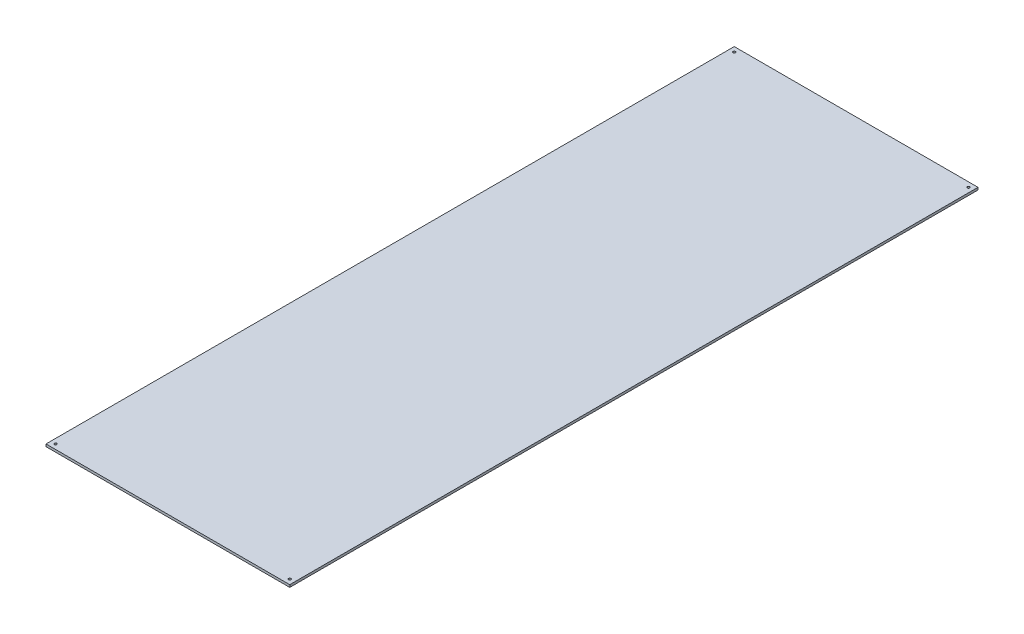
from build123d import *

# Parameters (mm, degrees)
SKETCH1_W           = 647.7
SKETCH1_H           = 1828.8
BOSS_EXTRUDE1_DEPTH = 6.35
SKETCH2_R           = 3.175
CUT_EXTRUDE1_DEPTH  = 971.075515102


with BuildPart() as part:
    # Sketch1 → Boss-Extrude1 (new body)
    with BuildSketch(Plane(origin=(0, 0, 0), x_dir=(1, 0, 0), z_dir=(0, 1, 0))):
        Rectangle(SKETCH1_W, SKETCH1_H)
    extrude(amount=BOSS_EXTRUDE1_DEPTH)

    # Sketch2 → Cut-Extrude1 (cut, through all)
    with BuildSketch(Plane(origin=(0, 6.35, 0), x_dir=(1, 0, 0), z_dir=(0, 1, 0))):
        with Locations(Location((311.15, -901.7, 0), (0, 0, 270))):
            Circle(SKETCH2_R)
        with Locations(Location((-311.15, -901.7, 0), (0, 0, 270))):
            Circle(SKETCH2_R)
        with Locations(Location((311.15, 901.7, 0), (0, 0, 270))):
            Circle(SKETCH2_R)
        with Locations(Location((-311.15, 901.7, 0), (0, 0, 270))):
            Circle(SKETCH2_R)
    extrude(amount=-CUT_EXTRUDE1_DEPTH, mode=Mode.SUBTRACT)


solid = part.part
